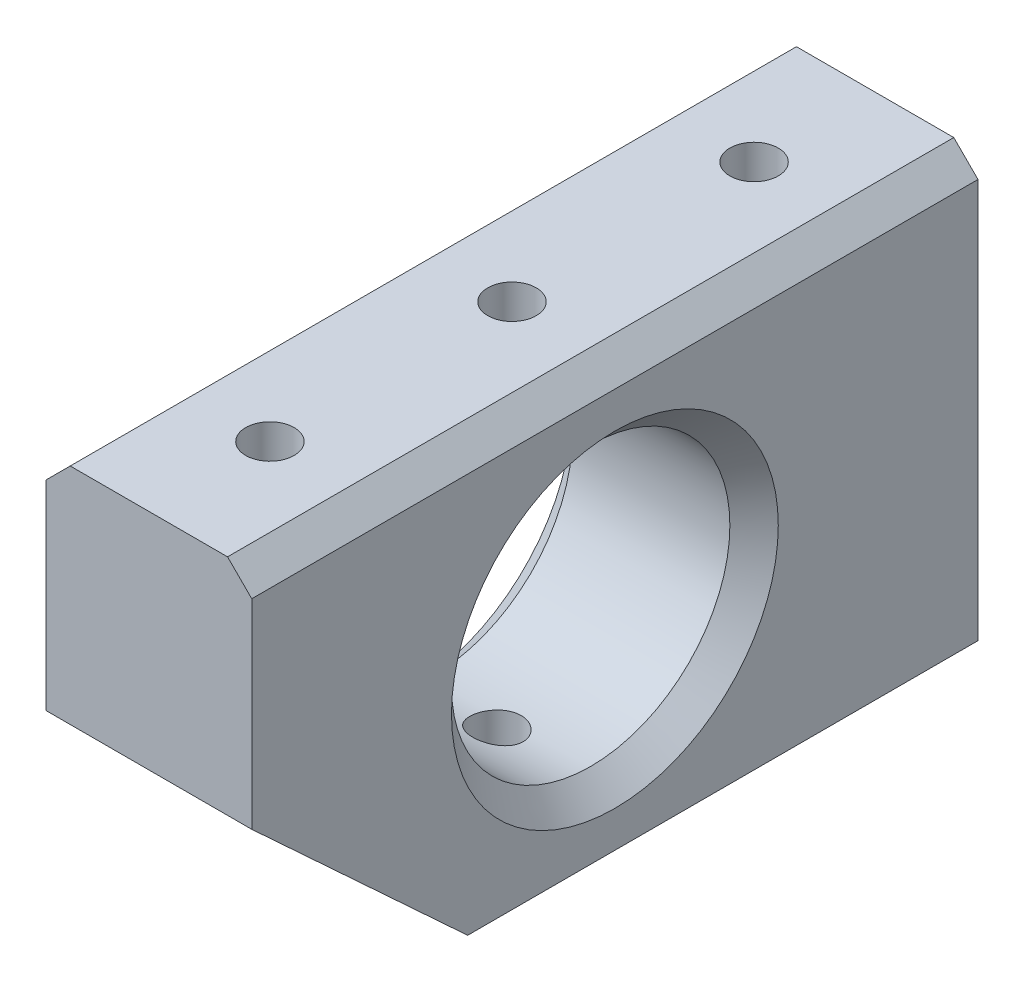
from build123d import *

# Parameters (mm, degrees)
SKETCH1_W               = 21.59
SKETCH1_H               = 46.99
BOSS_EXTRUDE1_DEPTH     = 76.2
SKETCH2_R               = 14.605
CUT_EXTRUDE1_DEPTH      = 93.090326311
CUT_EXTRUDE2_DEPTH      = 93.090326311
CUT_EXTRUDE3_REACH      = 94.09
SKETCH4_R               = 2.54
CUT_EXTRUDE4_REACH      = 94.09
CUT_EXTRUDE4_END_RADIUS = 14.605
SKETCH5_R               = 2.54
CHAMFER1_SIZE           = 2.54


with BuildPart() as part:
    # Sketch1 → Boss-Extrude1 (new body)
    with BuildSketch(Plane.XY):
        with Locations((10.795, 23.495)):
            Rectangle(SKETCH1_W, SKETCH1_H)
    extrude(amount=BOSS_EXTRUDE1_DEPTH)

    # Sketch2 → Cut-Extrude1 (cut, through all)
    with BuildSketch(Plane(origin=(21.59, 0, 0), x_dir=(0, 0, -1), z_dir=(1, 0, 0))):
        with Locations((-38.1, 23.495)):
            Circle(SKETCH2_R)
    extrude(amount=-CUT_EXTRUDE1_DEPTH, mode=Mode.SUBTRACT)

    # Sketch3 → Cut-Extrude2 (cut, through all)
    with BuildSketch(Plane(origin=(21.59, 0, 0), x_dir=(0, 0, -1), z_dir=(1, 0, 0))):
        Polygon((-50.8, 0), (-76.2, 23.495), (-76.2, 0), align=None)
    extrude(amount=-CUT_EXTRUDE2_DEPTH, mode=Mode.SUBTRACT)

    # Sketch4 → Cut-Extrude3 (cut, up to next)
    with BuildSketch(Plane(origin=(0, 46.99, 0), x_dir=(1, 0, 0), z_dir=(0, 1, 0)), mode=Mode.PRIVATE) as cut_extrude3_sk1:
        with Locations(Location((10.795, -12.7, 0), (0, 0, 270))):
            Circle(SKETCH4_R)
    cut_extrude3_tool1 = extrude(cut_extrude3_sk1.sketch, amount=-CUT_EXTRUDE3_REACH, mode=Mode.PRIVATE) & part.part
    # Sketch4 → Cut-Extrude3 (cut, up to next)
    with BuildSketch(Plane(origin=(0, 46.99, 0), x_dir=(1, 0, 0), z_dir=(0, 1, 0)), mode=Mode.PRIVATE) as cut_extrude3_sk2:
        with Locations(Location((10.795, -38.1, 0), (0, 0, 270))):
            Circle(SKETCH4_R)
    cut_extrude3_tool2 = extrude(cut_extrude3_sk2.sketch, amount=-CUT_EXTRUDE3_REACH, mode=Mode.PRIVATE) & part.part
    # Sketch4 → Cut-Extrude3 (cut, up to next)
    with BuildSketch(Plane(origin=(0, 46.99, 0), x_dir=(1, 0, 0), z_dir=(0, 1, 0)), mode=Mode.PRIVATE) as cut_extrude3_sk3:
        with Locations(Location((10.795, -63.5, 0), (0, 0, 270))):
            Circle(SKETCH4_R)
    cut_extrude3_tool3 = extrude(cut_extrude3_sk3.sketch, amount=-CUT_EXTRUDE3_REACH, mode=Mode.PRIVATE) & part.part
    add(cut_extrude3_tool1.solids().sort_by_distance((10.795, 46.99, 12.7))[0], mode=Mode.SUBTRACT)
    add(cut_extrude3_tool2.solids().sort_by_distance((10.795, 46.99, 38.1))[0], mode=Mode.SUBTRACT)
    add(cut_extrude3_tool3.solids().sort_by_distance((10.795, 46.99, 63.5))[0], mode=Mode.SUBTRACT)

    # Cut-Extrude4: up to this cylinder (the profile starts outside it)
    cut_extrude4_end = Plane(origin=(10.795, 23.495, 38.1), z_dir=(1, 0, 0)) * Cylinder(CUT_EXTRUDE4_END_RADIUS, 218.39, mode=Mode.PRIVATE)
    # Sketch5 → Cut-Extrude4 (cut, up to the surface)
    with BuildSketch(Plane.XZ, mode=Mode.PRIVATE) as cut_extrude4_sk1:
        with Locations(Location((10.795, 39.6875, 0), (0, 0, 270))):
            Circle(SKETCH5_R)
    cut_extrude4_tool1 = extrude(cut_extrude4_sk1.sketch, amount=-CUT_EXTRUDE4_REACH, mode=Mode.PRIVATE) - cut_extrude4_end
    add(cut_extrude4_tool1.solids().sort_by_distance((10.795, 0, 39.6875))[0], mode=Mode.SUBTRACT)

    # Chamfer1
    chamfer1_edges = [part.edges().sort_by_distance(p)[0] for p in [
        (0, 23.495, 52.705),
        (21.59, 23.495, 52.705),
        (21.59, 0, 25.4),
        (0, 0, 25.4),
        (0, 46.99, 38.1),
        (21.59, 46.99, 38.1),
    ]]
    chamfer(chamfer1_edges, length=CHAMFER1_SIZE)


solid = part.part
